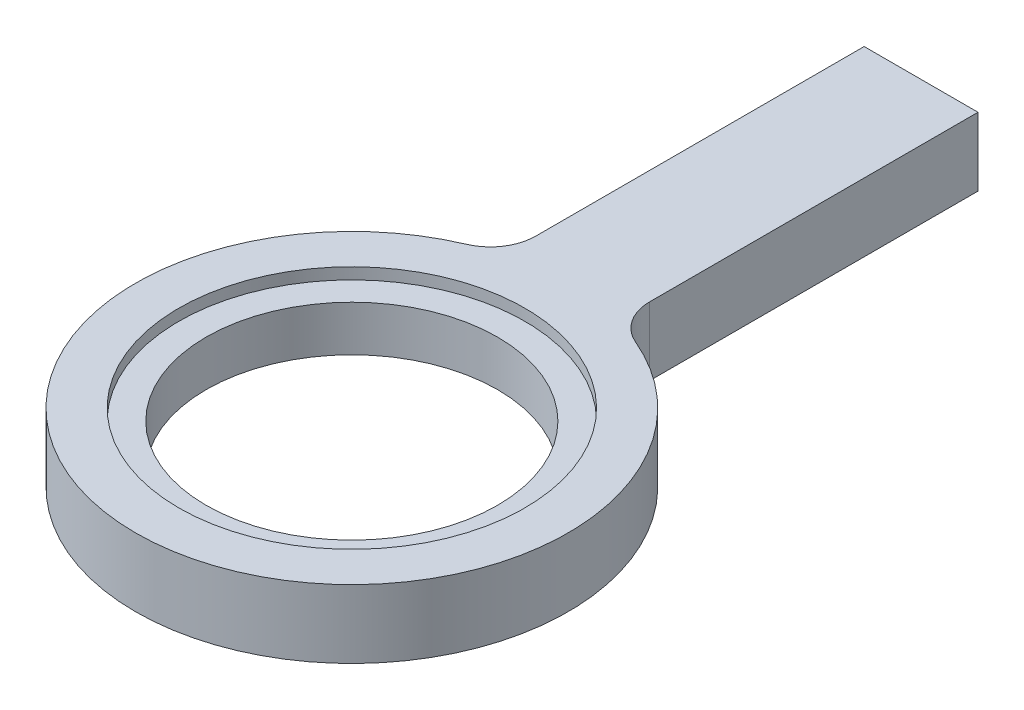
from build123d import *

# Parameters (mm, degrees)
SKETCH_1_R      = 9.5
SKETCH_1_R_2    = 6.4
EXTRUDE_1_DEPTH = 2
SKETCH_2_R      = 9.5
SKETCH_2_R_2    = 7.6
EXTRUDE_2_DEPTH = 0.5
EXTRUDE_START   = -2.5
SKETCH_2_2_R    = 9.5
SKETCH_2_2_R_2  = 7.6
EXTRUDE_3_DEPTH = 0.5
EXTRUDE_START_2 = -3
EXTRUDE_4_DEPTH = 3
FILLET_1_R      = 2


with BuildPart() as part:
    # 草图1 → 凸台-拉伸1 (new body)
    with BuildSketch(Plane(origin=(0, 0, 0), x_dir=(1, 0, 0), z_dir=(0, 1, 0))):
        with Locations(Location((0, 0, 0), (0, 0, 270))):
            Circle(SKETCH_1_R)
        with Locations(Location((0, 0, 0), (0, 0, 270))):
            Circle(SKETCH_1_R_2, mode=Mode.SUBTRACT)
    extrude(amount=EXTRUDE_1_DEPTH)

    # 草图2 → 凸台-拉伸2 (add)
    with BuildSketch(Plane(origin=(0, 2, 0), x_dir=(1, 0, 0), z_dir=(0, 1, 0))):
        with Locations(Location((0, 0, 0), (0, 0, 270))):
            Circle(SKETCH_2_R)
        with Locations(Location((0, 0, 0), (0, 0, 270))):
            Circle(SKETCH_2_R_2, mode=Mode.SUBTRACT)
    extrude(amount=EXTRUDE_2_DEPTH)

    # 草图2<2> → 凸台-拉伸3 (add)
    with BuildSketch(Plane(origin=(0, 2, 0), x_dir=(1, 0, 0), z_dir=(0, 1, 0)).offset(EXTRUDE_START)):
        with Locations(Location((0, 0, 0), (0, 0, 270))):
            Circle(SKETCH_2_2_R)
        with Locations(Location((0, 0, 0), (0, 0, 270))):
            Circle(SKETCH_2_2_R_2, mode=Mode.SUBTRACT)
    extrude(amount=EXTRUDE_3_DEPTH)

    # 草图4 → 凸台-拉伸4 (add)
    with BuildSketch(Plane(origin=(0, 2.5, 0), x_dir=(1, 0, 0), z_dir=(0, 1, 0)).offset(EXTRUDE_START_2)):
        with BuildLine():
            Line((-2.5, 25), (-2.5, 9.16515139))
            ThreePointArc((-2.5, 9.16515139), (0, 9.5), (2.5, 9.16515139))
            Line((2.5, 9.16515139), (2.5, 25))
            Line((2.5, 25), (-2.5, 25))
        make_face()
    extrude(amount=EXTRUDE_4_DEPTH)

    # 圆角1
    fillet_1_edges = [part.edges().sort_by_distance(p)[0] for p in [
        (2.5, 1, -9.16515139),
        (-2.5, 1, -9.16515139),
    ]]
    fillet(fillet_1_edges, radius=FILLET_1_R)


solid = part.part
